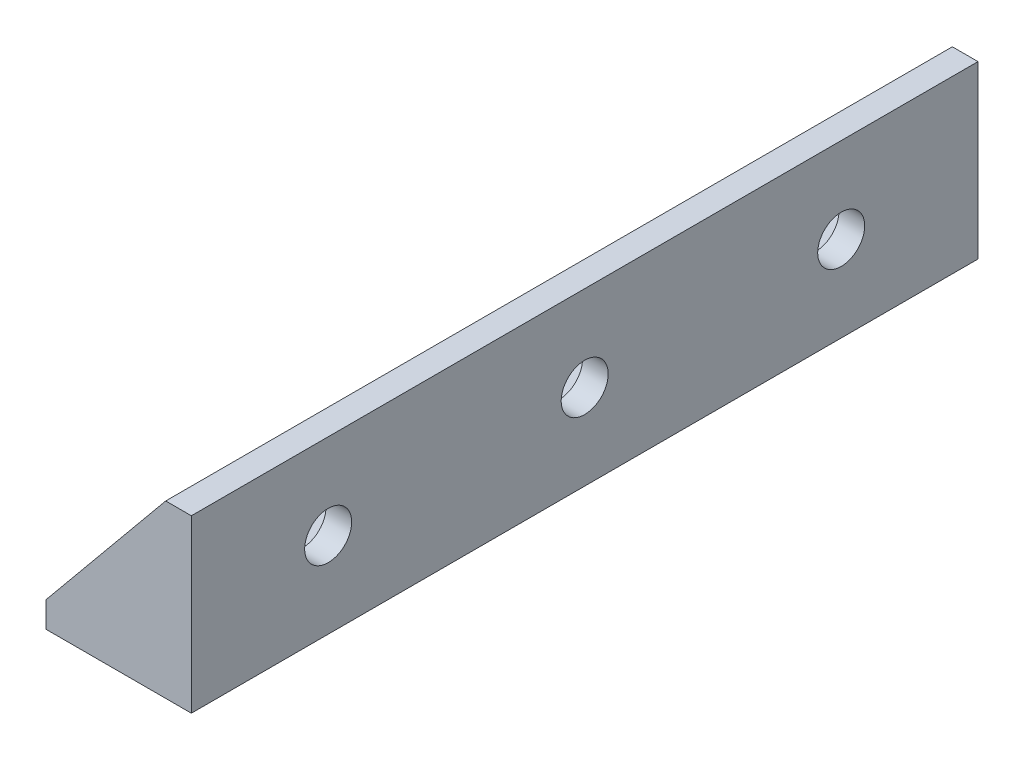
from build123d import *

# Parameters (mm, degrees)
SKETCH1_W               = 17
SKETCH1_H               = 92
SKETCH1_R               = 2.5
BOSS_EXTRUDE1_DEPTH     = 3
BOSS_EXTRUDE6_DEPTH     = 20
CUT_EXTRUDE2_DEPTH      = 95.678403028
CUT_EXTRUDE2_DEPTH_BACK = 95.678403028
SKETCH2_R               = 2.75
CUT_EXTRUDE1_DEPTH      = 5


with BuildPart() as part:
    # Sketch1 → Boss-Extrude1 (new body)
    with BuildSketch(Plane(origin=(0, 0, 0), x_dir=(1, 0, 0), z_dir=(0, 1, 0))):
        with Locations((1.5, 0)):
            Rectangle(SKETCH1_W, SKETCH1_H)
        with Locations((0, -30)):
            Circle(SKETCH1_R, mode=Mode.SUBTRACT)
        Circle(SKETCH1_R, mode=Mode.SUBTRACT)
        with Locations((0, 30)):
            Circle(SKETCH1_R, mode=Mode.SUBTRACT)
    extrude(amount=BOSS_EXTRUDE1_DEPTH)

    # Sketch1<3> → Boss-Extrude6 (add)
    with BuildSketch(Plane(origin=(0, 0, 0), x_dir=(1, 0, 0), z_dir=(0, 1, 0))):
        Polygon((-7, 46), (-7, 40), (7, 40), (7, 19), (-7, 19), (-7, 11), (7, 11), (7, -11), (-7, -11), (-7, -19), (7, -19), (7, -40), (-7, -40), (-7, -46), (7, -46), (10, -46), (10, -40), (10, -18), (10, -12), (10, 12), (10, 18), (10, 40), (10, 46), (7, 46), align=None)
    extrude(amount=BOSS_EXTRUDE6_DEPTH)

    # Sketch3 → Cut-Extrude2 (cut, two sides: drawn at the far end of the back side and taken through both)
    with BuildSketch(Plane.XY.offset(46).offset(-CUT_EXTRUDE2_DEPTH_BACK)):
        Polygon((-7, 20), (-7, 3), (7, 20), align=None)
    extrude(amount=CUT_EXTRUDE2_DEPTH + CUT_EXTRUDE2_DEPTH_BACK, mode=Mode.SUBTRACT)

    # Sketch2 → Cut-Extrude1 (cut)
    with BuildSketch(Plane.ZY.offset(-7)):
        with Locations((-30, 10)):
            Circle(SKETCH2_R)
        with Locations((0, 10)):
            Circle(SKETCH2_R)
        with Locations((30, 10)):
            Circle(SKETCH2_R)
    extrude(amount=-CUT_EXTRUDE1_DEPTH, mode=Mode.SUBTRACT)


solid = part.part
